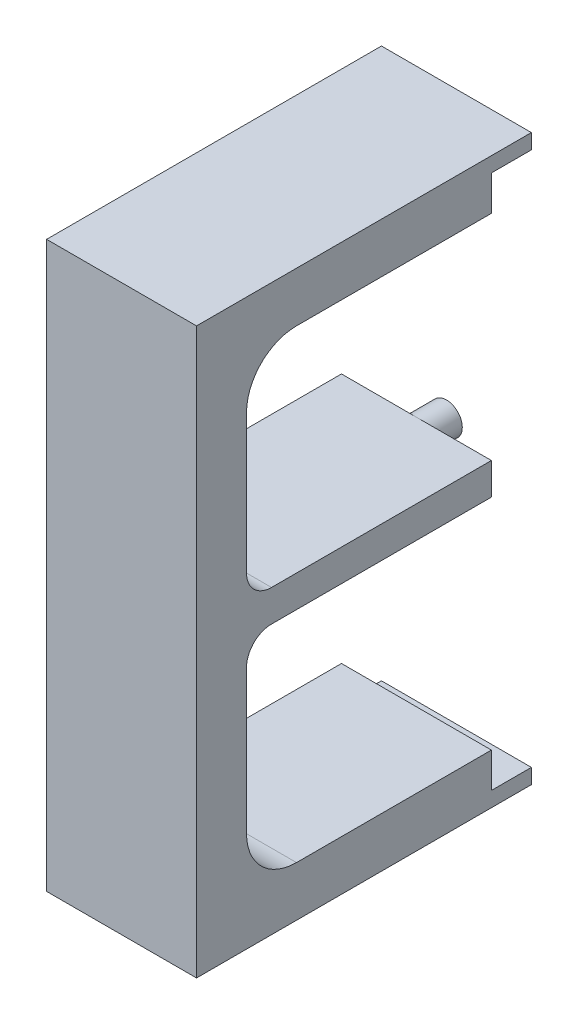
from build123d import *

# Parameters (mm, degrees)
BOSS_EXTRUDE3_DEPTH      = 57
BOSS_EXTRUDE3_DEPTH_BACK = 2
SKETCH1_W                = 30
SKETCH1_H                = 113
SKETCH1_6_R              = 3.175
BOSS_EXTRUDE4_DEPTH      = 8
CUT_EXTRUDE1_DEPTH       = 122.482509029
CUT_EXTRUDE1_DEPTH_BACK  = 122.482509029
SKETCH2_W                = 49
SKETCH2_H                = 42.825
SKETCH2_H_2              = 43.825
SKETCH3_W                = 30
SKETCH3_H                = 3
BOSS_EXTRUDE5_DEPTH      = 8
FILLET2_R                = 10
FILLET3_R                = 10
FILLET4_R                = 5
FILLET5_R                = 5


with BuildPart() as part:
    # Sketch1 → Boss-Extrude3 (new, two sides: drawn at the far end of the back side and taken through both)
    with BuildSketch(Plane.XY.offset(-BOSS_EXTRUDE3_DEPTH_BACK)):
        with Locations((0, -46.5)):
            Rectangle(SKETCH1_W, SKETCH1_H)
    extrude(amount=BOSS_EXTRUDE3_DEPTH + BOSS_EXTRUDE3_DEPTH_BACK)

    # Sketch1<6> → Boss-Extrude4 (add)
    with BuildSketch(Plane.XY):
        with Locations((0, -46)):
            Circle(SKETCH1_6_R)
    extrude(amount=-BOSS_EXTRUDE4_DEPTH)

    # Sketch2 → Cut-Extrude1 (cut, two sides: drawn at the far end of the back side and taken through both)
    with BuildSketch(Plane(origin=(15, 0, 0), x_dir=(0, 0, -1), z_dir=(1, 0, 0)).offset(-CUT_EXTRUDE1_DEPTH_BACK)):
        with Locations((-22.5, -21.4125)):
            Rectangle(SKETCH2_W, SKETCH2_H)
        with Locations((-22.5, -71.0875)):
            Rectangle(SKETCH2_W, SKETCH2_H_2)
    extrude(amount=CUT_EXTRUDE1_DEPTH + CUT_EXTRUDE1_DEPTH_BACK, mode=Mode.SUBTRACT)

    # Sketch3 → Boss-Extrude5 (add)
    with BuildSketch(Plane(origin=(0, 0, -2), x_dir=(-1, 0, 0), z_dir=(0, 0, -1))):
        with Locations((0, 8.5)):
            Rectangle(SKETCH3_W, SKETCH3_H)
        with Locations((0, -101.5)):
            Rectangle(SKETCH3_W, SKETCH3_H)
    extrude(amount=BOSS_EXTRUDE5_DEPTH)

    # Fillet2
    fillet2_edges = [part.edges().sort_by_distance(p)[0] for p in [
        (0, 0, 47),
    ]]
    fillet(fillet2_edges, radius=FILLET2_R)

    # Fillet3
    fillet3_edges = [part.edges().sort_by_distance(p)[0] for p in [
        (0, -93, 47),
    ]]
    fillet(fillet3_edges, radius=FILLET3_R)

    # Fillet4
    fillet4_edges = [part.edges().sort_by_distance(p)[0] for p in [
        (0, -42.825, 47),
    ]]
    fillet(fillet4_edges, radius=FILLET4_R)

    # Fillet5
    fillet5_edges = [part.edges().sort_by_distance(p)[0] for p in [
        (0, -49.175, 47),
    ]]
    fillet(fillet5_edges, radius=FILLET5_R)


solid = part.part
